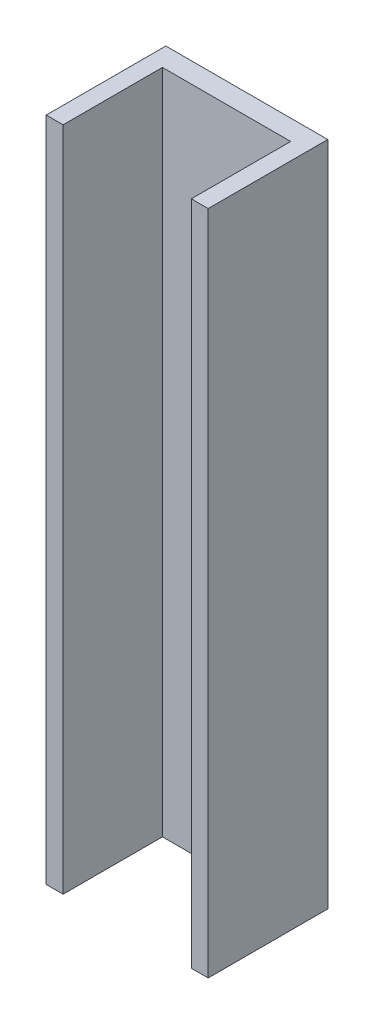
from build123d import *

# Parameters (mm, degrees)
BOSS_EXTRUDE1_DEPTH = 39.5
SKETCH3_R           = 1.3375
CUT_EXTRUDE1_DEPTH  = 40.1


with BuildPart() as part:
    # Sketch2 → Boss-Extrude1 (new body)
    with BuildSketch(Plane(origin=(0, 0, 0), x_dir=(1, 0, 0), z_dir=(0, 1, 0))):
        Polygon((-3.8, 0), (3.8, 0), (3.8, -5.89), (4.8, -5.89), (4.8, 1.2), (-4.8, 1.2), (-4.8, -5.89), (-3.8, -5.89), align=None)
    extrude(amount=BOSS_EXTRUDE1_DEPTH)

    # Sketch3 → Cut-Extrude1 (cut)
    with BuildSketch(Plane(origin=(0, 0, -1.2), x_dir=(-1, 0, 0), z_dir=(0, 0, -1))):
        with Locations((0, 19.75)):
            Circle(SKETCH3_R)
    extrude(amount=-CUT_EXTRUDE1_DEPTH, mode=Mode.SUBTRACT)


solid = part.part
